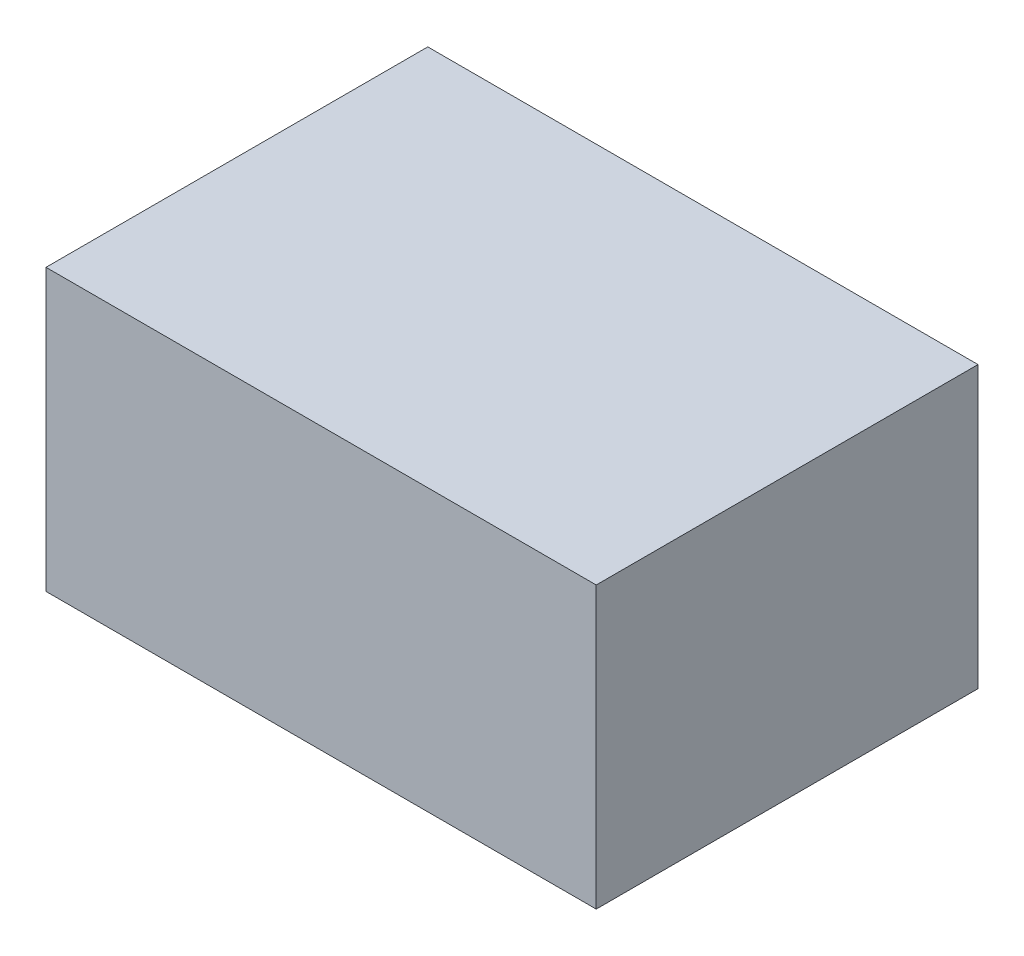
from build123d import *

# Parameters (mm, degrees)
SKETCH1_W           = 49
SKETCH1_H           = 25
BOSS_EXTRUDE1_DEPTH = 34


with BuildPart() as part:
    # Sketch1 → Boss-Extrude1 (new body)
    with BuildSketch(Plane.XY):
        Rectangle(SKETCH1_W, SKETCH1_H)
    extrude(amount=BOSS_EXTRUDE1_DEPTH)


solid = part.part
